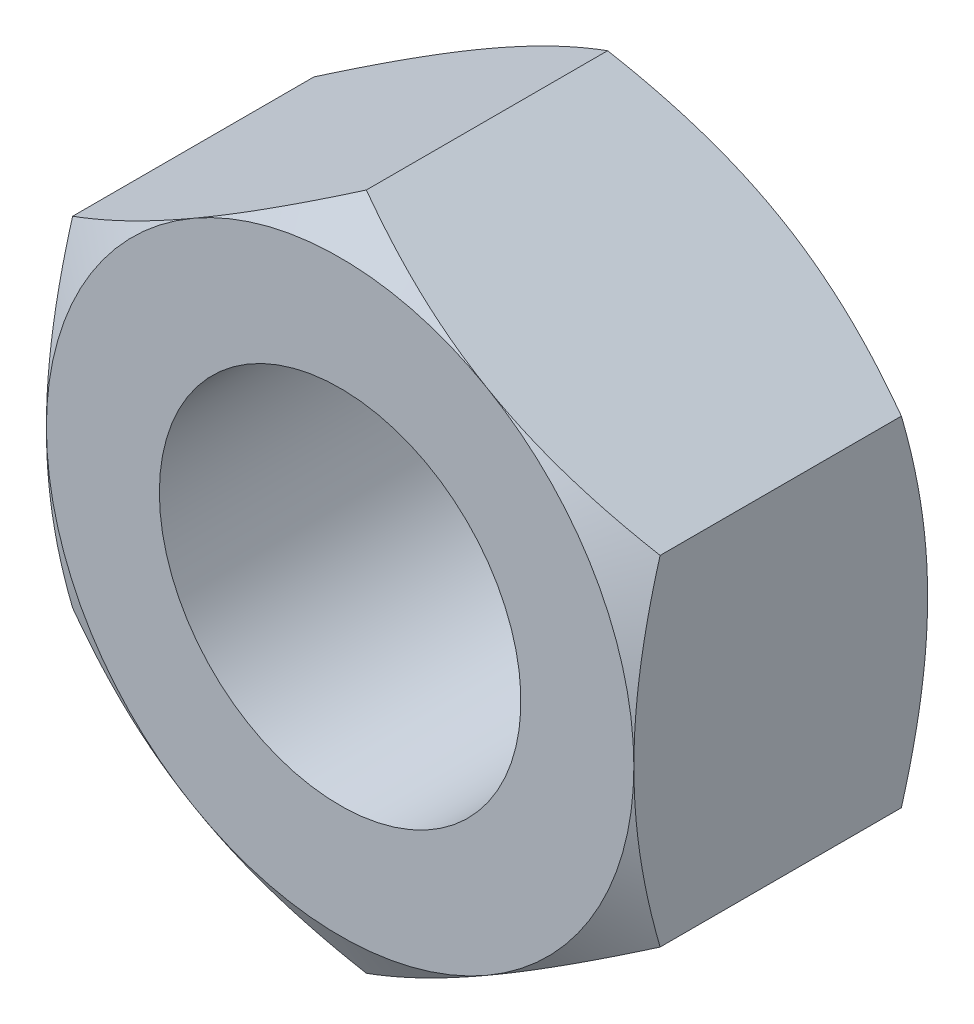
from build123d import *

# Parameters (mm, degrees)
EXTRUDE1_DEPTH          = 3.25
SKETCH13_R              = 4
BOSS_EXTRUDE1_DEPTH     = 6.5
SKETCH7_OUTSIDE_W       = 107.168
SKETCH7_OUTSIDE_H       = 109.18
SKETCH7_OUTSIDE_R       = 6.5
EXTRUDE2_DEPTH          = 25.4
EXTRUDE2_DRAFT          = -60
MIRROR2_COPY_1_SKETCH_W = 107.168
MIRROR2_COPY_1_SKETCH_H = 109.18
MIRROR2_COPY_1_SKETCH_R = 6.5
MIRROR2_COPY_1_DEPTH    = 25.4
MIRROR2_COPY_1_DRAFT    = -60


with BuildPart() as part:
    # Sketch1 → Extrude1 (new, symmetric)
    with BuildSketch(Plane.XY):
        Polygon((-6.5, 3.75277675), (-6.5, -3.75277675), (0, -7.505553499), (6.5, -3.75277675), (6.5, 3.75277675), (0, 7.505553499), align=None)
    extrude(amount=EXTRUDE1_DEPTH, both=True)


with BuildPart() as body_2:
    # Sketch13 → Boss-Extrude1 (new body)
    with BuildSketch(Plane(origin=(0, 0, -3.25), x_dir=(-1, 0, 0), z_dir=(0, 0, -1))):
        Circle(SKETCH13_R)
    extrude(amount=-BOSS_EXTRUDE1_DEPTH)


with BuildPart() as part_1:
    add(part.part)

    # Combine1: cut body 2
    add(body_2.part, mode=Mode.SUBTRACT)


with BuildPart() as extrude2_tool:
    # Sketch7 outside → Extrude2 (with draft: the straight prism first)
    with BuildSketch(Plane.XY.offset(3.25)):
        Rectangle(SKETCH7_OUTSIDE_W, SKETCH7_OUTSIDE_H)
        Circle(SKETCH7_OUTSIDE_R, mode=Mode.SUBTRACT)
    extrude(amount=-EXTRUDE2_DEPTH)
    # Extrude2: the draft: its side faces are tilted about the plane it starts from
    extrude2_sides = [extrude2_tool.faces().sort_by_distance(p)[0] for p in [
        (0, -54.59, -9.45),
        (53.584, 0, -9.45),
        (0, 54.59, -9.45),
        (-53.584, 0, -9.45),
        (-6.5, 0, -9.45),
    ]]
    draft(extrude2_sides, Plane.XY.offset(3.25), EXTRUDE2_DRAFT)


with BuildPart() as part_2:
    add(part_1.part)

    # Extrude2: cut by extrude2_tool
    add(extrude2_tool.part, mode=Mode.SUBTRACT)


with BuildPart() as mirror2_copy_1_tool:
    # Mirror2 copy 1 sketch → Mirror2 copy 1 (with draft: the straight prism first)
    with BuildSketch(Plane(origin=(0, 0, -3.25), x_dir=(1, 0, 0), z_dir=(0, 0, -1))):
        Rectangle(MIRROR2_COPY_1_SKETCH_W, MIRROR2_COPY_1_SKETCH_H)
        Circle(MIRROR2_COPY_1_SKETCH_R, mode=Mode.SUBTRACT)
    extrude(amount=-MIRROR2_COPY_1_DEPTH)
    # Mirror2 copy 1: the draft: its side faces are tilted about the plane it starts from
    mirror2_copy_1_sides = [mirror2_copy_1_tool.faces().sort_by_distance(p)[0] for p in [
        (0, -54.59, 9.45),
        (53.584, 0, 9.45),
        (0, 54.59, 9.45),
        (-53.584, 0, 9.45),
        (-6.5, 0, 9.45),
    ]]
    draft(mirror2_copy_1_sides, Plane(origin=(0, 0, -3.25), x_dir=(1, 0, 0), z_dir=(0, 0, -1)), MIRROR2_COPY_1_DRAFT)


with BuildPart() as part_3:
    add(part_2.part)

    # Mirror2 copy 1: cut by mirror2_copy_1_tool
    add(mirror2_copy_1_tool.part, mode=Mode.SUBTRACT)


solid = part_3.part
